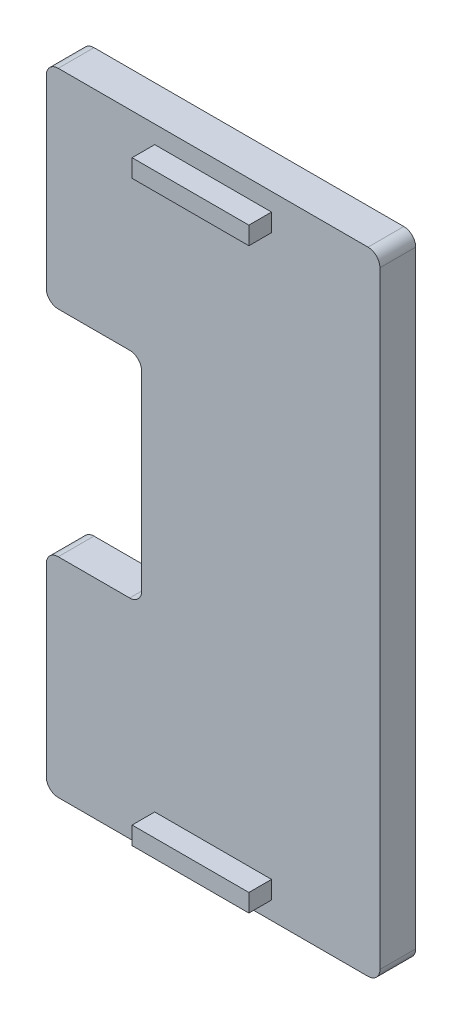
from build123d import *

# Parameters (mm, degrees)
SKETCH1_W           = 28
SKETCH1_H           = 53
SKETCH1_W_2         = 22
SKETCH1_H_2         = 47
BOSS_EXTRUDE1_DEPTH = 3
SKETCH3_W           = 9.8
SKETCH3_H           = 1.5
BOSS_EXTRUDE2_DEPTH = 1.9
SKETCH4_W           = 16
SKETCH4_H           = 18
CUT_EXTRUDE1_DEPTH  = 57.116040488
FILLET1_R           = 1


with BuildPart() as part:
    # Sketch1 → Boss-Extrude1 (new body)
    # profile 1 of 2: a face of its own
    with BuildSketch(Plane.XY):
        with Locations((11, 23.5)):
            Rectangle(SKETCH1_W, SKETCH1_H)
        with Locations((11, 23.5)):
            Rectangle(SKETCH1_W_2, SKETCH1_H_2, mode=Mode.SUBTRACT)
    # profile 2 of 2: a face of its own
    with BuildSketch(Plane.XY):
        with Locations((11, 23.5)):
            Rectangle(SKETCH1_W_2, SKETCH1_H_2)
    extrude(amount=BOSS_EXTRUDE1_DEPTH)

    # Sketch3 → Boss-Extrude2 (add)
    with BuildSketch(Plane.XY.offset(3)):
        with Locations((11, 47.75)):
            Rectangle(SKETCH3_W, SKETCH3_H)
        with Locations((11, -0.75)):
            Rectangle(SKETCH3_W, SKETCH3_H)
    extrude(amount=BOSS_EXTRUDE2_DEPTH)

    # Sketch4 → Cut-Extrude1 (cut, through all)
    with BuildSketch(Plane(origin=(0, 0, 0), x_dir=(-1, 0, 0), z_dir=(0, 0, -1))):
        with Locations((3, 23.5)):
            Rectangle(SKETCH4_W, SKETCH4_H)
    extrude(amount=-CUT_EXTRUDE1_DEPTH, mode=Mode.SUBTRACT)

    # Fillet1
    fillet1_edges = [part.edges().sort_by_distance(p)[0] for p in [
        (-3, 14.5, 1.5),
        (-3, 32.5, 1.5),
        (5, 14.5, 1.5),
        (5, 32.5, 1.5),
        (-3, -3, 1.5),
        (-3, 50, 1.5),
        (25, 50, 1.5),
        (25, -3, 1.5),
    ]]
    fillet(fillet1_edges, radius=FILLET1_R)


solid = part.part
